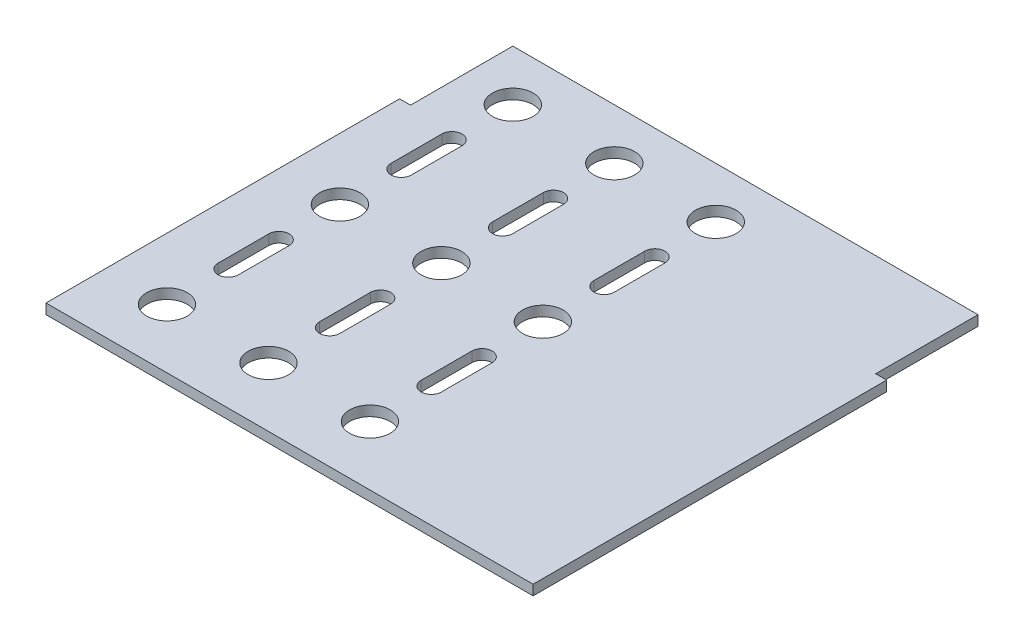
from build123d import *

# Parameters (mm, degrees)
SKETCH1_W           = 152.4
SKETCH1_H           = 142.621
BOSS_EXTRUDE1_DEPTH = 3.175
SKETCH2_W           = 3.429
SKETCH2_H           = 32.004
CUT_EXTRUDE1_DEPTH  = 209.750066505
CUT_EXTRUDE2_REACH  = 210.75
SKETCH3_R           = 6.35


with BuildPart() as part:
    # Sketch1 → Boss-Extrude1 (new body)
    with BuildSketch(Plane(origin=(0, 0, 0), x_dir=(1, 0, 0), z_dir=(0, 1, 0))):
        with Locations((76.2, 71.3105)):
            Rectangle(SKETCH1_W, SKETCH1_H)
    extrude(amount=BOSS_EXTRUDE1_DEPTH)

    # Sketch2 → Cut-Extrude1 (cut, through all)
    with BuildSketch(Plane(origin=(0, 3.175, 0), x_dir=(1, 0, 0), z_dir=(0, 1, 0))):
        with Locations((1.7145, 126.619)):
            Rectangle(SKETCH2_W, SKETCH2_H)
        with Locations((150.6855, 126.619)):
            Rectangle(SKETCH2_W, SKETCH2_H)
    extrude(amount=-CUT_EXTRUDE1_DEPTH, mode=Mode.SUBTRACT)

    # Sketch3 → Cut-Extrude2 (cut, up to next)
    with BuildSketch(Plane(origin=(0, 3.175, 0), x_dir=(1, 0, 0), z_dir=(0, 1, 0)), mode=Mode.PRIVATE) as cut_extrude2_sk1:
        with Locations(Location((19.304, 126.746, 0), (0, 0, 270))):
            Circle(SKETCH3_R)
    cut_extrude2_tool1 = extrude(cut_extrude2_sk1.sketch, amount=-CUT_EXTRUDE2_REACH, mode=Mode.PRIVATE) & part.part
    # Sketch3 → Cut-Extrude2 (cut, up to next)
    with BuildSketch(Plane(origin=(0, 3.175, 0), x_dir=(1, 0, 0), z_dir=(0, 1, 0)), mode=Mode.PRIVATE) as cut_extrude2_sk2:
        with Locations(Location((51.054, 126.746, 0), (0, 0, 270))):
            Circle(SKETCH3_R)
    cut_extrude2_tool2 = extrude(cut_extrude2_sk2.sketch, amount=-CUT_EXTRUDE2_REACH, mode=Mode.PRIVATE) & part.part
    # Sketch3 → Cut-Extrude2 (cut, up to next)
    with BuildSketch(Plane(origin=(0, 3.175, 0), x_dir=(1, 0, 0), z_dir=(0, 1, 0)), mode=Mode.PRIVATE) as cut_extrude2_sk3:
        with Locations(Location((82.804, 126.746, 0), (0, 0, 270))):
            Circle(SKETCH3_R)
    cut_extrude2_tool3 = extrude(cut_extrude2_sk3.sketch, amount=-CUT_EXTRUDE2_REACH, mode=Mode.PRIVATE) & part.part
    # Sketch3 → Cut-Extrude2 (cut, up to next)
    with BuildSketch(Plane(origin=(0, 3.175, 0), x_dir=(1, 0, 0), z_dir=(0, 1, 0)), mode=Mode.PRIVATE) as cut_extrude2_sk4:
        with Locations(Location((19.304, 72.644, 0), (0, 0, 270))):
            Circle(SKETCH3_R)
    cut_extrude2_tool4 = extrude(cut_extrude2_sk4.sketch, amount=-CUT_EXTRUDE2_REACH, mode=Mode.PRIVATE) & part.part
    # Sketch3 → Cut-Extrude2 (cut, up to next)
    with BuildSketch(Plane(origin=(0, 3.175, 0), x_dir=(1, 0, 0), z_dir=(0, 1, 0)), mode=Mode.PRIVATE) as cut_extrude2_sk5:
        with Locations(Location((51.054, 72.644, 0), (0, 0, 270))):
            Circle(SKETCH3_R)
    cut_extrude2_tool5 = extrude(cut_extrude2_sk5.sketch, amount=-CUT_EXTRUDE2_REACH, mode=Mode.PRIVATE) & part.part
    # Sketch3 → Cut-Extrude2 (cut, up to next)
    with BuildSketch(Plane(origin=(0, 3.175, 0), x_dir=(1, 0, 0), z_dir=(0, 1, 0)), mode=Mode.PRIVATE) as cut_extrude2_sk6:
        with Locations(Location((82.804, 72.644, 0), (0, 0, 270))):
            Circle(SKETCH3_R)
    cut_extrude2_tool6 = extrude(cut_extrude2_sk6.sketch, amount=-CUT_EXTRUDE2_REACH, mode=Mode.PRIVATE) & part.part
    # Sketch3 → Cut-Extrude2 (cut, up to next)
    with BuildSketch(Plane(origin=(0, 3.175, 0), x_dir=(1, 0, 0), z_dir=(0, 1, 0)), mode=Mode.PRIVATE) as cut_extrude2_sk7:
        with Locations(Location((19.304, 18.542, 0), (0, 0, 270))):
            Circle(SKETCH3_R)
    cut_extrude2_tool7 = extrude(cut_extrude2_sk7.sketch, amount=-CUT_EXTRUDE2_REACH, mode=Mode.PRIVATE) & part.part
    # Sketch3 → Cut-Extrude2 (cut, up to next)
    with BuildSketch(Plane(origin=(0, 3.175, 0), x_dir=(1, 0, 0), z_dir=(0, 1, 0)), mode=Mode.PRIVATE) as cut_extrude2_sk8:
        with Locations(Location((51.054, 18.542, 0), (0, 0, 270))):
            Circle(SKETCH3_R)
    cut_extrude2_tool8 = extrude(cut_extrude2_sk8.sketch, amount=-CUT_EXTRUDE2_REACH, mode=Mode.PRIVATE) & part.part
    # Sketch3 → Cut-Extrude2 (cut, up to next)
    with BuildSketch(Plane(origin=(0, 3.175, 0), x_dir=(1, 0, 0), z_dir=(0, 1, 0)), mode=Mode.PRIVATE) as cut_extrude2_sk9:
        with Locations(Location((82.804, 18.542, 0), (0, 0, 270))):
            Circle(SKETCH3_R)
    cut_extrude2_tool9 = extrude(cut_extrude2_sk9.sketch, amount=-CUT_EXTRUDE2_REACH, mode=Mode.PRIVATE) & part.part
    # Sketch3 → Cut-Extrude2 (cut, up to next)
    with BuildSketch(Plane(origin=(0, 3.175, 0), x_dir=(1, 0, 0), z_dir=(0, 1, 0)), mode=Mode.PRIVATE) as cut_extrude2_sk10:
        with BuildLine():
            Line((22.479, 107.696), (22.479, 91.821))
            ThreePointArc((22.479, 91.821), (19.304, 88.646), (16.129, 91.821))
            Line((16.129, 91.821), (16.129, 107.696))
            ThreePointArc((16.129, 107.696), (19.304, 110.871), (22.479, 107.696))
        make_face()
    cut_extrude2_tool10 = extrude(cut_extrude2_sk10.sketch, amount=-CUT_EXTRUDE2_REACH, mode=Mode.PRIVATE) & part.part
    # Sketch3 → Cut-Extrude2 (cut, up to next)
    with BuildSketch(Plane(origin=(0, 3.175, 0), x_dir=(1, 0, 0), z_dir=(0, 1, 0)), mode=Mode.PRIVATE) as cut_extrude2_sk11:
        with BuildLine():
            Line((54.229, 107.696), (54.229, 91.821))
            ThreePointArc((54.229, 91.821), (51.054, 88.646), (47.879, 91.821))
            Line((47.879, 91.821), (47.879, 107.696))
            ThreePointArc((47.879, 107.696), (51.054, 110.871), (54.229, 107.696))
        make_face()
    cut_extrude2_tool11 = extrude(cut_extrude2_sk11.sketch, amount=-CUT_EXTRUDE2_REACH, mode=Mode.PRIVATE) & part.part
    # Sketch3 → Cut-Extrude2 (cut, up to next)
    with BuildSketch(Plane(origin=(0, 3.175, 0), x_dir=(1, 0, 0), z_dir=(0, 1, 0)), mode=Mode.PRIVATE) as cut_extrude2_sk12:
        with BuildLine():
            Line((85.979, 107.696), (85.979, 91.821))
            ThreePointArc((85.979, 91.821), (82.804, 88.646), (79.629, 91.821))
            Line((79.629, 91.821), (79.629, 107.696))
            ThreePointArc((79.629, 107.696), (82.804, 110.871), (85.979, 107.696))
        make_face()
    cut_extrude2_tool12 = extrude(cut_extrude2_sk12.sketch, amount=-CUT_EXTRUDE2_REACH, mode=Mode.PRIVATE) & part.part
    # Sketch3 → Cut-Extrude2 (cut, up to next)
    with BuildSketch(Plane(origin=(0, 3.175, 0), x_dir=(1, 0, 0), z_dir=(0, 1, 0)), mode=Mode.PRIVATE) as cut_extrude2_sk13:
        with BuildLine():
            Line((22.479, 53.594), (22.479, 37.719))
            ThreePointArc((22.479, 37.719), (19.304, 34.544), (16.129, 37.719))
            Line((16.129, 37.719), (16.129, 53.594))
            ThreePointArc((16.129, 53.594), (19.304, 56.769), (22.479, 53.594))
        make_face()
    cut_extrude2_tool13 = extrude(cut_extrude2_sk13.sketch, amount=-CUT_EXTRUDE2_REACH, mode=Mode.PRIVATE) & part.part
    # Sketch3 → Cut-Extrude2 (cut, up to next)
    with BuildSketch(Plane(origin=(0, 3.175, 0), x_dir=(1, 0, 0), z_dir=(0, 1, 0)), mode=Mode.PRIVATE) as cut_extrude2_sk14:
        with BuildLine():
            Line((54.229, 53.594), (54.229, 37.719))
            ThreePointArc((54.229, 37.719), (51.054, 34.544), (47.879, 37.719))
            Line((47.879, 37.719), (47.879, 53.594))
            ThreePointArc((47.879, 53.594), (51.054, 56.769), (54.229, 53.594))
        make_face()
    cut_extrude2_tool14 = extrude(cut_extrude2_sk14.sketch, amount=-CUT_EXTRUDE2_REACH, mode=Mode.PRIVATE) & part.part
    # Sketch3 → Cut-Extrude2 (cut, up to next)
    with BuildSketch(Plane(origin=(0, 3.175, 0), x_dir=(1, 0, 0), z_dir=(0, 1, 0)), mode=Mode.PRIVATE) as cut_extrude2_sk15:
        with BuildLine():
            Line((85.979, 53.594), (85.979, 37.719))
            ThreePointArc((85.979, 37.719), (82.804, 34.544), (79.629, 37.719))
            Line((79.629, 37.719), (79.629, 53.594))
            ThreePointArc((79.629, 53.594), (82.804, 56.769), (85.979, 53.594))
        make_face()
    cut_extrude2_tool15 = extrude(cut_extrude2_sk15.sketch, amount=-CUT_EXTRUDE2_REACH, mode=Mode.PRIVATE) & part.part
    add(cut_extrude2_tool1.solids().sort_by_distance((19.304, 3.175, -126.746))[0], mode=Mode.SUBTRACT)
    add(cut_extrude2_tool2.solids().sort_by_distance((51.054, 3.175, -126.746))[0], mode=Mode.SUBTRACT)
    add(cut_extrude2_tool3.solids().sort_by_distance((82.804, 3.175, -126.746))[0], mode=Mode.SUBTRACT)
    add(cut_extrude2_tool4.solids().sort_by_distance((19.304, 3.175, -72.644))[0], mode=Mode.SUBTRACT)
    add(cut_extrude2_tool5.solids().sort_by_distance((51.054, 3.175, -72.644))[0], mode=Mode.SUBTRACT)
    add(cut_extrude2_tool6.solids().sort_by_distance((82.804, 3.175, -72.644))[0], mode=Mode.SUBTRACT)
    add(cut_extrude2_tool7.solids().sort_by_distance((19.304, 3.175, -18.542))[0], mode=Mode.SUBTRACT)
    add(cut_extrude2_tool8.solids().sort_by_distance((51.054, 3.175, -18.542))[0], mode=Mode.SUBTRACT)
    add(cut_extrude2_tool9.solids().sort_by_distance((82.804, 3.175, -18.542))[0], mode=Mode.SUBTRACT)
    add(cut_extrude2_tool10.solids().sort_by_distance((19.304, 3.175, -99.7585))[0], mode=Mode.SUBTRACT)
    add(cut_extrude2_tool11.solids().sort_by_distance((51.054, 3.175, -99.7585))[0], mode=Mode.SUBTRACT)
    add(cut_extrude2_tool12.solids().sort_by_distance((82.804, 3.175, -99.7585))[0], mode=Mode.SUBTRACT)
    add(cut_extrude2_tool13.solids().sort_by_distance((19.304, 3.175, -45.6565))[0], mode=Mode.SUBTRACT)
    add(cut_extrude2_tool14.solids().sort_by_distance((51.054, 3.175, -45.6565))[0], mode=Mode.SUBTRACT)
    add(cut_extrude2_tool15.solids().sort_by_distance((82.804, 3.175, -45.6565))[0], mode=Mode.SUBTRACT)


solid = part.part
